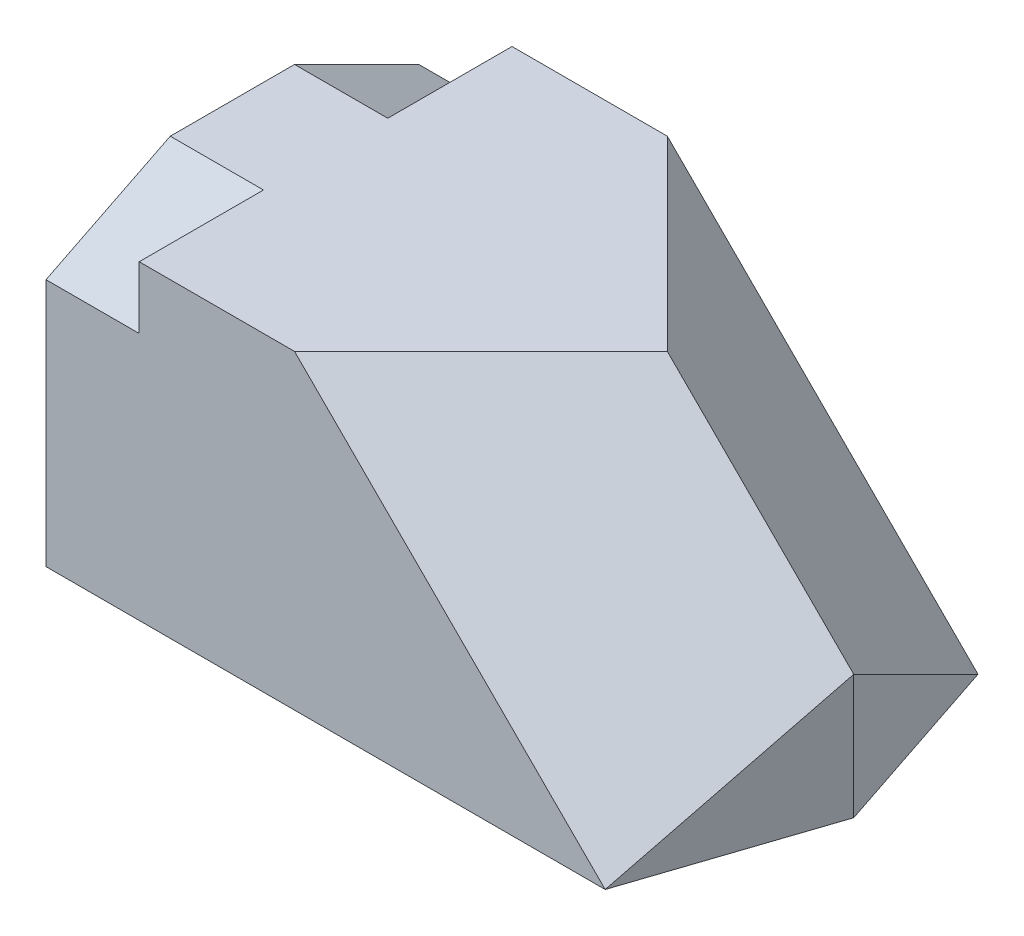
from build123d import *

# Parameters (mm, degrees)
SKETCH_2_W          = 100
SKETCH_2_H          = 50
EXTRUDE_1_DEPTH     = 30
CUT_EXTRUDE_1_DEPTH = 165.121269
CUT_EXTRUDE_2_DEPTH = 120.163752878
CUT_EXTRUDE_4_DEPTH = 15


with BuildPart() as part:
    # 스케치2 → 보스-돌출1 (new, symmetric)
    with BuildSketch(Plane.XY):
        with Locations((50, 25)):
            Rectangle(SKETCH_2_W, SKETCH_2_H)
    extrude(amount=EXTRUDE_1_DEPTH, both=True)

    # 스케치7 → 컷-돌출1 (cut, through all, along a direction that is not the sketch's normal)
    with BuildSketch(Plane(origin=(0, 50, 0), x_dir=(1, 0, 0), z_dir=(0, 1, 0))):
        Polygon((100, 0), (70, 0), (40, -30), (100, -30), align=None)
        Polygon((40, 30), (70, 0), (100, 0), (100, 30), align=None)
    extrude(amount=-CUT_EXTRUDE_1_DEPTH, dir=(-0.7071067811865475, 0.7071067811865476, 0), mode=Mode.SUBTRACT)

    # 스케치10 → 컷-돌출2 (cut, through all)
    with BuildSketch(Plane(origin=(90, 0, 30), x_dir=(-0.31622776601683805, 0, 0.9486832980505138), z_dir=(-0.9486832980505138, 0, -0.31622776601683805))):
        Polygon((-31.622776602, 20), (-31.622776602, 0), (0, 0), align=None)
    cut_extrude_2 = extrude(amount=-CUT_EXTRUDE_2_DEPTH, mode=Mode.SUBTRACT)

    # 대칭 복사1: 컷-돌출2 across plane
    add(cut_extrude_2.mirror(Plane.XY), mode=Mode.SUBTRACT)

    # 스케치11 → 컷-돌출4 (cut)
    with BuildSketch(Plane.ZY):
        Polygon((-30, 40), (-10, 50), (-30, 50), align=None)
        Polygon((30, 40), (10, 50), (30, 50), align=None)
    extrude(amount=-CUT_EXTRUDE_4_DEPTH, mode=Mode.SUBTRACT)


solid = part.part
